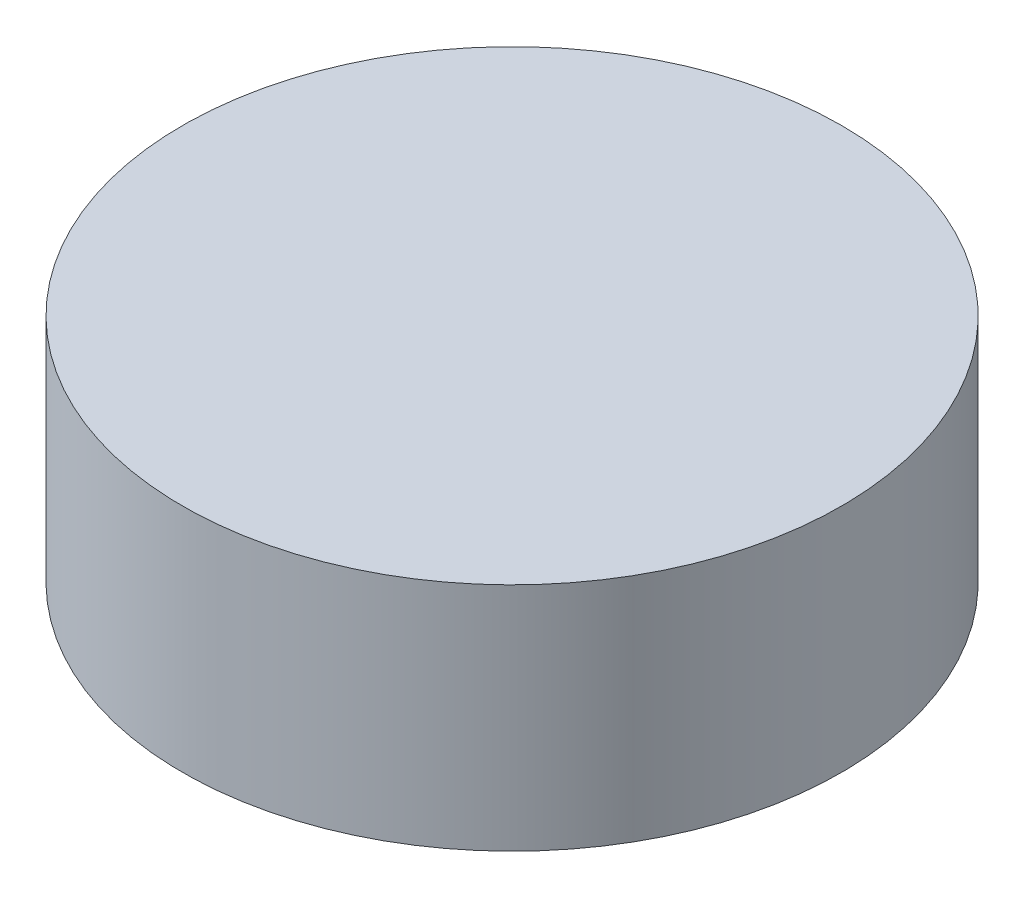
from build123d import *

# Parameters (mm, degrees)
SKTACOPVC2_R   = 20
TACOPVC2_DEPTH = 14


with BuildPart() as part:
    # SkTacoPVC2 → TacoPVC2 (new body)
    with BuildSketch(Plane(origin=(0, 18, 0), x_dir=(1, 0, 0), z_dir=(0, 1, 0))):
        with Locations(Location((-75, 129.903810568, 0), (0, 0, 90))):
            Circle(SKTACOPVC2_R)
    extrude(amount=TACOPVC2_DEPTH)


solid = part.part
